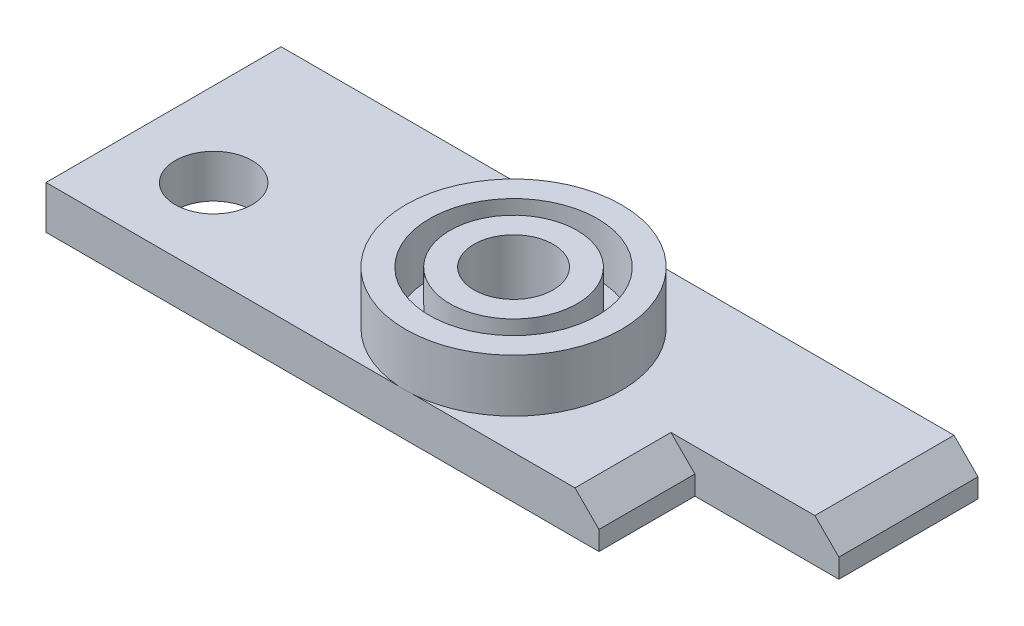
from build123d import *

# Parameters (mm, degrees)
BOSS_EXTRUDE1_DEPTH = 1.8
SKETCH3_R           = 1.6
CUT_EXTRUDE1_DEPTH  = 31.775680334
SKETCH4_R           = 2.65
BOSS_EXTRUDE2_DEPTH = 4
SKETCH5_R           = 1.65
CUT_EXTRUDE2_DEPTH  = 31.98229333
SKETCH7_R           = 4.5
SKETCH7_R_2         = 3.5
BOSS_EXTRUDE4_DEPTH = 2.2
CHAMFER2_SIZE       = 1


with BuildPart() as part:
    # Sketch1 → Boss-Extrude1 (new body)
    with BuildSketch(Plane(origin=(0, 0, 0), x_dir=(1, 0, 0), z_dir=(0, 1, 0))):
        Polygon((0, 0.2), (23.05, 0.2), (23.05, 4.2), (29.05, 4.2), (29.05, 10), (0, 10), (0, 4.2), align=None)
    extrude(amount=BOSS_EXTRUDE1_DEPTH)

    # Sketch3 → Cut-Extrude1 (cut, through all)
    with BuildSketch(Plane.XZ):
        with Locations(Location((3.5, -3.689750901, 0), (0, 0, 270))):
            Circle(SKETCH3_R)
    extrude(amount=-CUT_EXTRUDE1_DEPTH, mode=Mode.SUBTRACT)

    # Sketch4 → Boss-Extrude2 (add)
    with BuildSketch(Plane.XZ):
        with Locations(Location((15, -4.689750901, 0), (0, 0, 270))):
            Circle(SKETCH4_R)
    extrude(amount=-BOSS_EXTRUDE2_DEPTH)

    # Sketch5 → Cut-Extrude2 (cut, through all)
    with BuildSketch(Plane(origin=(0, 4, 0), x_dir=(1, 0, 0), z_dir=(0, 1, 0))):
        with Locations(Location((15, 4.689750901, 0), (0, 0, 270))):
            Circle(SKETCH5_R)
    extrude(amount=-CUT_EXTRUDE2_DEPTH, mode=Mode.SUBTRACT)

    # Sketch7 → Boss-Extrude4 (add)
    with BuildSketch(Plane(origin=(0, 1.8, 0), x_dir=(1, 0, 0), z_dir=(0, 1, 0))):
        with Locations(Location((15, 4.689750901, 0), (0, 0, 90))):
            Circle(SKETCH7_R)
        with Locations(Location((15, 4.689750901, 0), (0, 0, 90))):
            Circle(SKETCH7_R_2, mode=Mode.SUBTRACT)
    extrude(amount=BOSS_EXTRUDE4_DEPTH)

    # Chamfer2
    chamfer2_edges = [part.edges().sort_by_distance(p)[0] for p in [
        (23.05, 1.8, -2.2),
        (29.05, 1.8, -7.1),
    ]]
    chamfer(chamfer2_edges, length=CHAMFER2_SIZE)


solid = part.part
